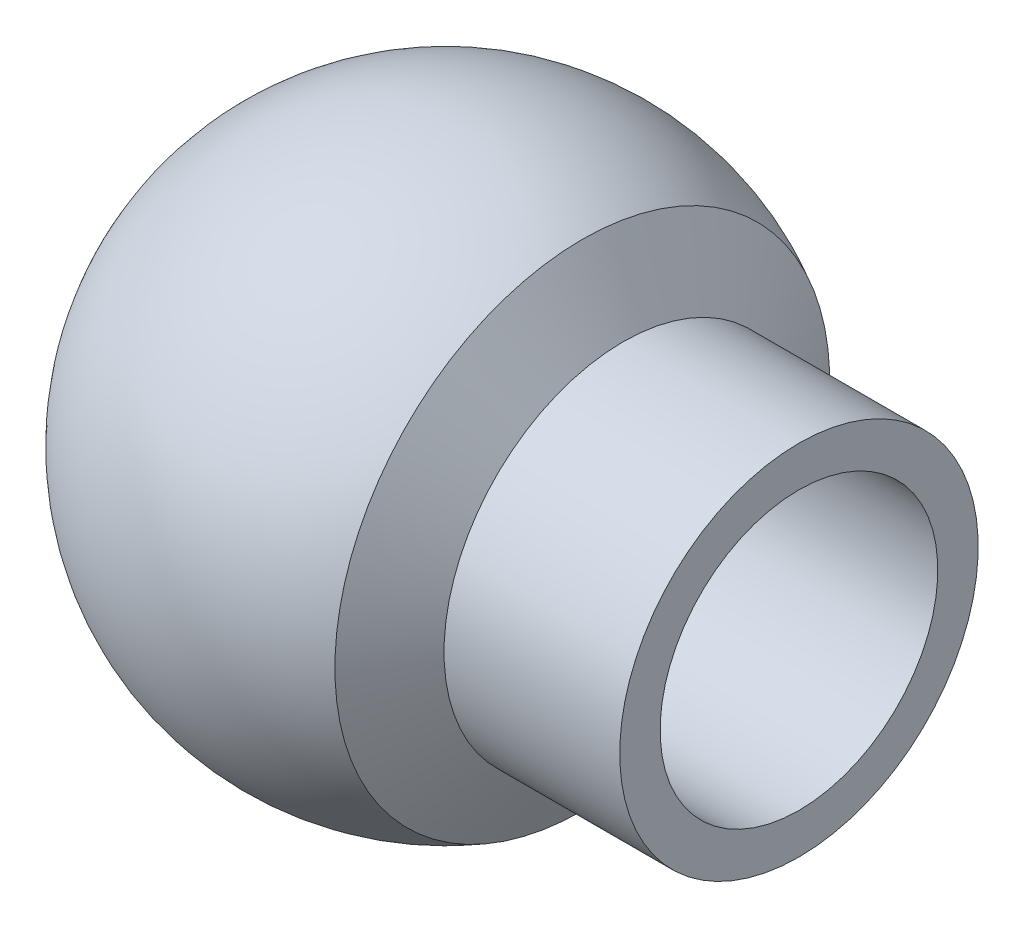
from build123d import *


with BuildPart() as part:
    # Sketch1 → Revolve1 (revolve)
    with BuildSketch(Plane.XY):
        with BuildLine():
            Line((0, 4.005023834), (0, 2.005023834))
            Line((0, 2.005023834), (-20, 2.005023834))
            Line((-20, 2.005023834), (-20, -4.869976166))
            Line((-20, -4.869976166), (-31.5, -4.869976166))
            ThreePointArc((-31.5, -4.869976166), (-24.612275243, 7.188860464), (-10.726351305, 7.382276009))
            Line((-10.726351305, 7.382276009), (-8.7, 4.005023834))
            Line((-8.7, 4.005023834), (0, 4.005023834))
        make_face()
    revolve(axis=Axis((-20, -4.869976166, 0), (-1, 0, 0)))


solid = part.part
